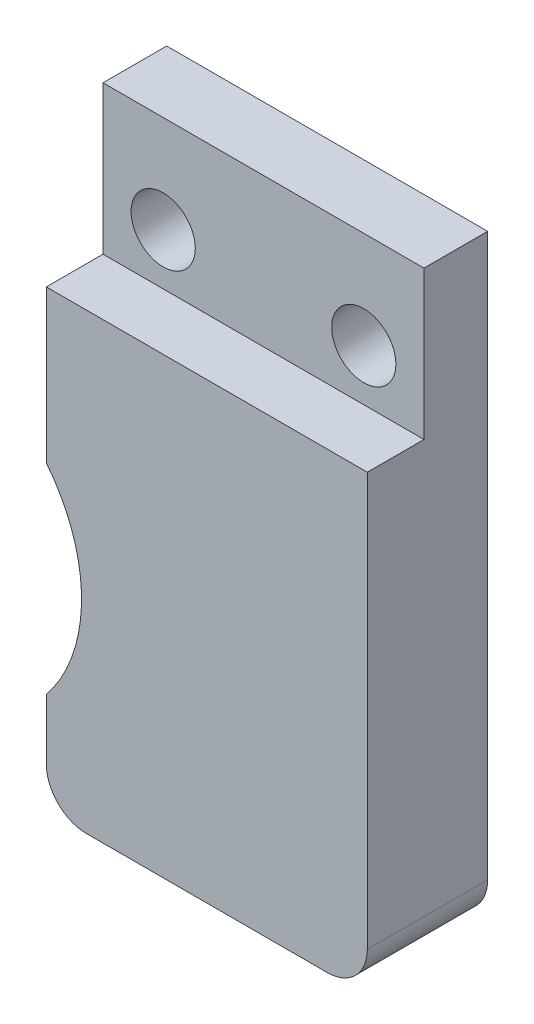
from build123d import *

# Parameters (mm, degrees)
SKETCH1_W               = 16
SKETCH1_H               = 30
SKETCH1_R               = 1.6
BOSS_EXTRUDE1_DEPTH     = 3.175
SKETCH3_W               = 16
SKETCH3_H               = 22.6
BOSS_EXTRUDE2_DEPTH     = 6
FILLET1_R               = 2
CUT_EXTRUDE1_DEPTH      = 51.735398146
CUT_EXTRUDE1_DEPTH_BACK = 51.735398146


with BuildPart() as part:
    # Sketch1 → Boss-Extrude1 (new body)
    with BuildSketch(Plane.XY):
        with Locations((0, -35)):
            Rectangle(SKETCH1_W, SKETCH1_H)
        with Locations((5, -24.85)):
            Circle(SKETCH1_R, mode=Mode.SUBTRACT)
        with Locations((-5, -24.85)):
            Circle(SKETCH1_R, mode=Mode.SUBTRACT)
    extrude(amount=BOSS_EXTRUDE1_DEPTH)

    # Sketch3 → Boss-Extrude2 (add)
    with BuildSketch(Plane(origin=(0, 0, 0), x_dir=(-1, 0, 0), z_dir=(0, 0, -1))):
        with Locations((0, -38.7)):
            Rectangle(SKETCH3_W, SKETCH3_H)
    extrude(amount=-BOSS_EXTRUDE2_DEPTH)

    # Fillet1
    fillet1_edges = [part.edges().sort_by_distance(p)[0] for p in [
        (8, -50, 3),
        (-8, -50, 3),
    ]]
    fillet(fillet1_edges, radius=FILLET1_R)

    # Sketch4 → Cut-Extrude1 (cut, two sides: drawn at the far end of the back side and taken through both)
    with BuildSketch(Plane.XY.offset(3.175).offset(-CUT_EXTRUDE1_DEPTH_BACK)):
        with BuildLine():
            Line((-8, -45), (-8, -35))
            ThreePointArc((-8, -35), (-6.244997998, -40), (-8, -45))
        make_face()
    extrude(amount=CUT_EXTRUDE1_DEPTH + CUT_EXTRUDE1_DEPTH_BACK, mode=Mode.SUBTRACT)


solid = part.part
